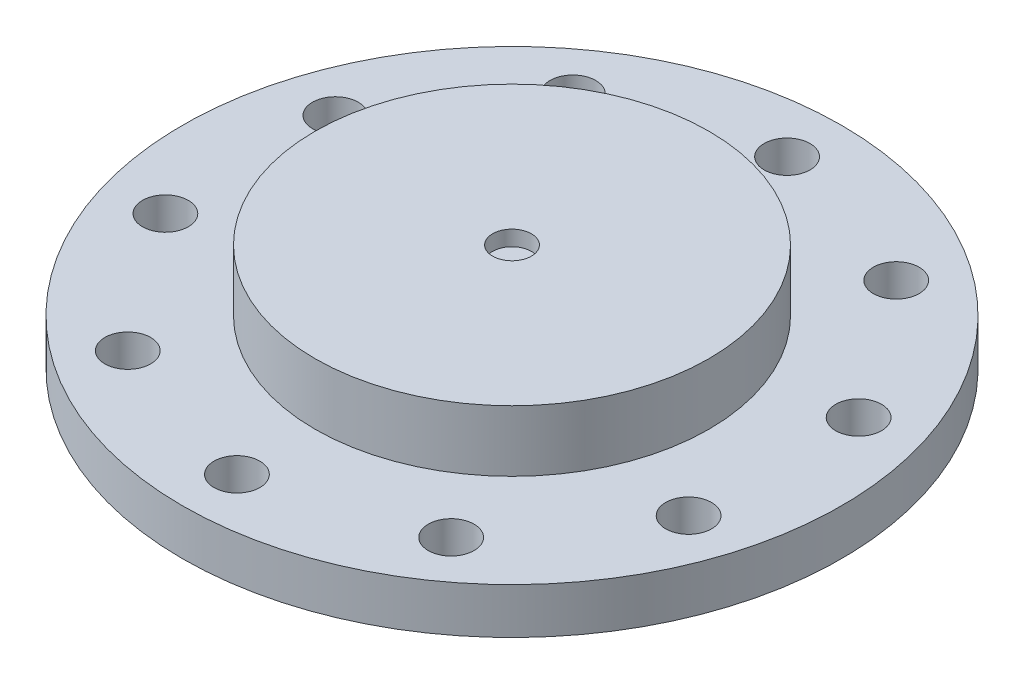
from build123d import *

# Parameters (mm, degrees)
SKETCH2_R           = 107.826846
SKETCH2_R_2         = 7.5
BOSS_EXTRUDE1_DEPTH = 15
SKETCH3_R           = 71.687
SKETCH3_R_2         = 64.447846
CUT_EXTRUDE1_DEPTH  = 3
SKETCH4_W           = 3
SKETCH4_H           = 5
CUT_EXTRUDE2_DEPTH  = 154.226164334
CIRPATTERN1_COUNT   = 35
SKETCH6_R           = 64.447846
SKETCH6_R_2         = 6.35
BOSS_EXTRUDE3_DEPTH = 10
SKETCH8_W           = 3
SKETCH8_H           = 5
CUT_EXTRUDE4_DEPTH  = 155.525911861
CIRPATTERN7_COUNT   = 35
SKETCH9_R           = 64.447846
SKETCH9_R_2         = 57.826846
BOSS_EXTRUDE4_DEPTH = 5
SKETCH10_R          = 64.447846
SKETCH10_R_2        = 6.35
BOSS_EXTRUDE5_DEPTH = 5
SKETCH11_R          = 47.826846
SKETCH11_R_2        = 36.6524
BOSS_EXTRUDE7_DEPTH = 10
SKETCH12_R          = 6.35
CUT_EXTRUDE5_DEPTH  = 154.796155468
SKETCH13_R          = 0.8262
CUT_EXTRUDE6_DEPTH  = 155.525911861


with BuildPart() as part:
    # Sketch2 → Boss-Extrude1 (new body)
    with BuildSketch(Plane(origin=(0, 0, 0), x_dir=(1, 0, 0), z_dir=(0, 1, 0))):
        with Locations(Location((0, 0, 0), (0, 0, 270))):
            Circle(SKETCH2_R)
        with Locations(Location((0, 90, 0), (0, 0, 270))):
            Circle(SKETCH2_R_2, mode=Mode.SUBTRACT)
        with Locations(Location((52.900672706, 72.811529494, 0), (0, 0, 270))):
            Circle(SKETCH2_R_2, mode=Mode.SUBTRACT)
        with Locations(Location((85.595086467, 27.811529494, 0), (0, 0, 270))):
            Circle(SKETCH2_R_2, mode=Mode.SUBTRACT)
        with Locations(Location((85.595086467, -27.811529494, 0), (0, 0, 270))):
            Circle(SKETCH2_R_2, mode=Mode.SUBTRACT)
        with Locations(Location((52.900672706, -72.811529494, 0), (0, 0, 270))):
            Circle(SKETCH2_R_2, mode=Mode.SUBTRACT)
        with Locations(Location((0, -90, 0), (0, 0, 270))):
            Circle(SKETCH2_R_2, mode=Mode.SUBTRACT)
        with Locations(Location((-52.900672706, -72.811529494, 0), (0, 0, 270))):
            Circle(SKETCH2_R_2, mode=Mode.SUBTRACT)
        with Locations(Location((-85.595086467, -27.811529494, 0), (0, 0, 270))):
            Circle(SKETCH2_R_2, mode=Mode.SUBTRACT)
        with Locations(Location((-85.595086467, 27.811529494, 0), (0, 0, 270))):
            Circle(SKETCH2_R_2, mode=Mode.SUBTRACT)
        with Locations(Location((-52.900672706, 72.811529494, 0), (0, 0, 270))):
            Circle(SKETCH2_R_2, mode=Mode.SUBTRACT)
    extrude(amount=BOSS_EXTRUDE1_DEPTH)

    # Sketch3 → Cut-Extrude1 (cut)
    with BuildSketch(Plane.XZ):
        with Locations(Location((0, 0, 0), (0, 0, 270))):
            Circle(SKETCH3_R)
        with Locations(Location((0, 0, 0), (0, 0, 270))):
            Circle(SKETCH3_R_2, mode=Mode.SUBTRACT)
    extrude(amount=-CUT_EXTRUDE1_DEPTH, mode=Mode.SUBTRACT)

    # Sketch4 → Cut-Extrude2 (cut, through all)
    with BuildSketch(Plane(origin=(0, 15, 0), x_dir=(1, 0, 0), z_dir=(0, 1, 0))):
        with Locations((0, 55.326846)):
            Rectangle(SKETCH4_W, SKETCH4_H)
    cut_extrude2 = extrude(amount=-CUT_EXTRUDE2_DEPTH, mode=Mode.SUBTRACT)

    # CirPattern1: Cut-Extrude2 ×35 about axis
    cirpattern1_axis = Axis((0, 0, 0), (0, 1, 0))
    for i in range(1, CIRPATTERN1_COUNT):
        add(cut_extrude2.rotate(cirpattern1_axis, i * 360 / CIRPATTERN1_COUNT), mode=Mode.SUBTRACT)



with BuildPart() as body_2:
    # Sketch6 → Boss-Extrude3 (new body)
    with BuildSketch(Plane(origin=(0, 15, 0), x_dir=(1, 0, 0), z_dir=(0, 1, 0))):
        with Locations(Location((0, 0, 0), (0, 0, 90))):
            Circle(SKETCH6_R)
        with Locations(Location((0, 0, 0), (0, 0, 270))):
            Circle(SKETCH6_R_2, mode=Mode.SUBTRACT)
    extrude(amount=BOSS_EXTRUDE3_DEPTH)

    # Sketch8 → Cut-Extrude4 (cut, through all)
    with BuildSketch(Plane(origin=(0, 25, 0), x_dir=(1, 0, 0), z_dir=(0, 1, 0))):
        with Locations((0, 55.326846)):
            Rectangle(SKETCH8_W, SKETCH8_H)
    cut_extrude4 = extrude(amount=-CUT_EXTRUDE4_DEPTH, mode=Mode.SUBTRACT)

    # CirPattern7: Cut-Extrude4 ×35 about axis
    cirpattern7_axis = Axis((0, 0, 0), (0, 1, 0))
    for i in range(1, CIRPATTERN7_COUNT):
        add(cut_extrude4.rotate(cirpattern7_axis, i * 360 / CIRPATTERN7_COUNT), mode=Mode.SUBTRACT)

    # Sketch9 → Boss-Extrude4 (add)
    with BuildSketch(Plane(origin=(0, 25, 0), x_dir=(1, 0, 0), z_dir=(0, 1, 0))):
        with Locations(Location((0, 0, 0), (0, 0, 90))):
            Circle(SKETCH9_R)
        with Locations(Location((0, 0, 0), (0, 0, 90))):
            Circle(SKETCH9_R_2, mode=Mode.SUBTRACT)
    extrude(amount=BOSS_EXTRUDE4_DEPTH)

    # Sketch10 → Boss-Extrude5 (add)
    with BuildSketch(Plane(origin=(0, 30, 0), x_dir=(1, 0, 0), z_dir=(0, 1, 0))):
        with Locations(Location((0, 0, 0), (0, 0, 90))):
            Circle(SKETCH10_R)
        with Locations(Location((0, 0, 0), (0, 0, 270))):
            Circle(SKETCH10_R_2, mode=Mode.SUBTRACT)
    extrude(amount=BOSS_EXTRUDE5_DEPTH)


with BuildPart() as part_1:
    add(part.part)

    add(body_2.part)  # Boss-Extrude7 merges body 2
    # Sketch11 → Boss-Extrude7 (add)
    with BuildSketch(Plane(origin=(0, 15, 0), x_dir=(1, 0, 0), z_dir=(0, 1, 0))):
        Circle(SKETCH11_R)
        Circle(SKETCH11_R_2, mode=Mode.SUBTRACT)
    extrude(amount=BOSS_EXTRUDE7_DEPTH)

    # Sketch12 → Cut-Extrude5 (cut, through all)
    with BuildSketch(Plane(origin=(0, 15, 0), x_dir=(1, 0, 0), z_dir=(0, 1, 0))):
        with Locations(Location((0, 0, 0), (0, 0, 270))):
            Circle(SKETCH12_R)
    extrude(amount=-CUT_EXTRUDE5_DEPTH, mode=Mode.SUBTRACT)

    # Sketch13 → Cut-Extrude6 (cut, through all)
    with BuildSketch(Plane(origin=(0, 25, 0), x_dir=(1, 0, 0), z_dir=(0, 1, 0))):
        with Locations(Location((0, 35, 0), (0, 0, 270))):
            Circle(SKETCH13_R)
        with Locations(Location((30.310889132, -17.5, 0), (0, 0, 270))):
            Circle(SKETCH13_R)
        with Locations(Location((-30.310889132, -17.5, 0), (0, 0, 270))):
            Circle(SKETCH13_R)
    extrude(amount=-CUT_EXTRUDE6_DEPTH, mode=Mode.SUBTRACT)


solid = part_1.part
